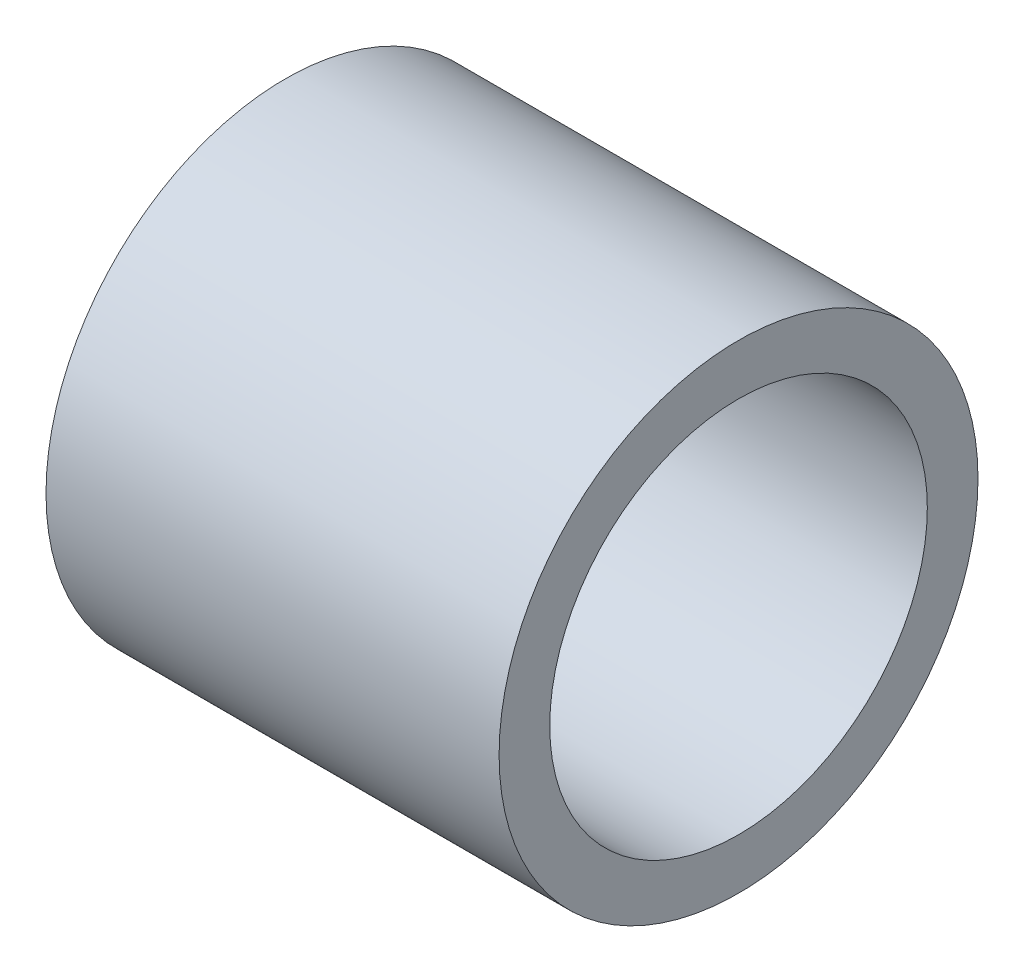
from build123d import *

# Parameters (mm, degrees)
SKETCH2_R           = 12.081568866
SKETCH2_R_2         = 9.525
BOSS_EXTRUDE1_DEPTH = 22.86


with BuildPart() as part:
    # Sketch2 → Boss-Extrude1 (new body)
    with BuildSketch(Plane(origin=(0, 0, 0), x_dir=(0, 0, -1), z_dir=(1, 0, 0))):
        Circle(SKETCH2_R)
        Circle(SKETCH2_R_2, mode=Mode.SUBTRACT)
    extrude(amount=BOSS_EXTRUDE1_DEPTH)


solid = part.part
